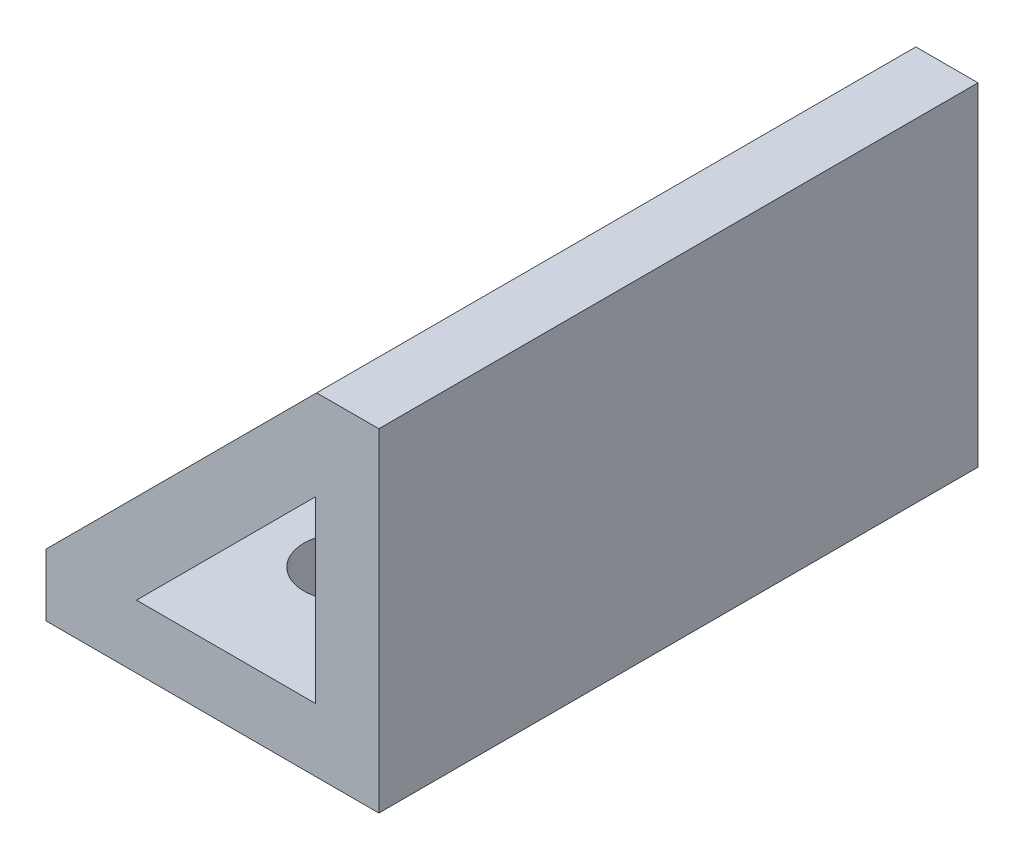
from build123d import *

# Parameters (mm, degrees)
BOSS_EXTRUDE1_DEPTH = 45.72
SKETCH2_R           = 3.175
CUT_EXTRUDE1_DEPTH  = 59.143257563
SKETCH4_R           = 6.35
CUT_EXTRUDE2_DEPTH  = 19.05


with BuildPart() as part:
    # Sketch1 → Boss-Extrude1 (new body)
    with BuildSketch(Plane.XY):
        Polygon((-4.745410922, 25.4), (-25.4, 4.745410922), (-25.4, 0), (0, 0), (0, 25.4), align=None)
        Polygon((-4.826, 18.49441627), (-4.826, 4.826), (-18.49441627, 4.826), align=None, mode=Mode.SUBTRACT)
    extrude(amount=BOSS_EXTRUDE1_DEPTH)

    # Sketch2 → Cut-Extrude1 (cut, through all)
    with BuildSketch(Plane.XZ):
        with Locations(Location((-12.7, 35.56, 0), (0, 0, 270))):
            Circle(SKETCH2_R)
        with Locations(Location((-12.7, 10.16, 0), (0, 0, 270))):
            Circle(SKETCH2_R)
    extrude(amount=-CUT_EXTRUDE1_DEPTH, mode=Mode.SUBTRACT)

    # Sketch4 → Cut-Extrude2 (cut)
    with BuildSketch(Plane(origin=(0, 25.4, 0), x_dir=(1, 0, 0), z_dir=(0, 1, 0))):
        with Locations(Location((-12.7, -10.16, 0), (0, 0, 227.739186389))):
            Circle(SKETCH4_R)
        with Locations(Location((-12.7, -35.56, 0), (0, 0, 227.739186389))):
            Circle(SKETCH4_R)
    extrude(amount=-CUT_EXTRUDE2_DEPTH, mode=Mode.SUBTRACT)


solid = part.part
